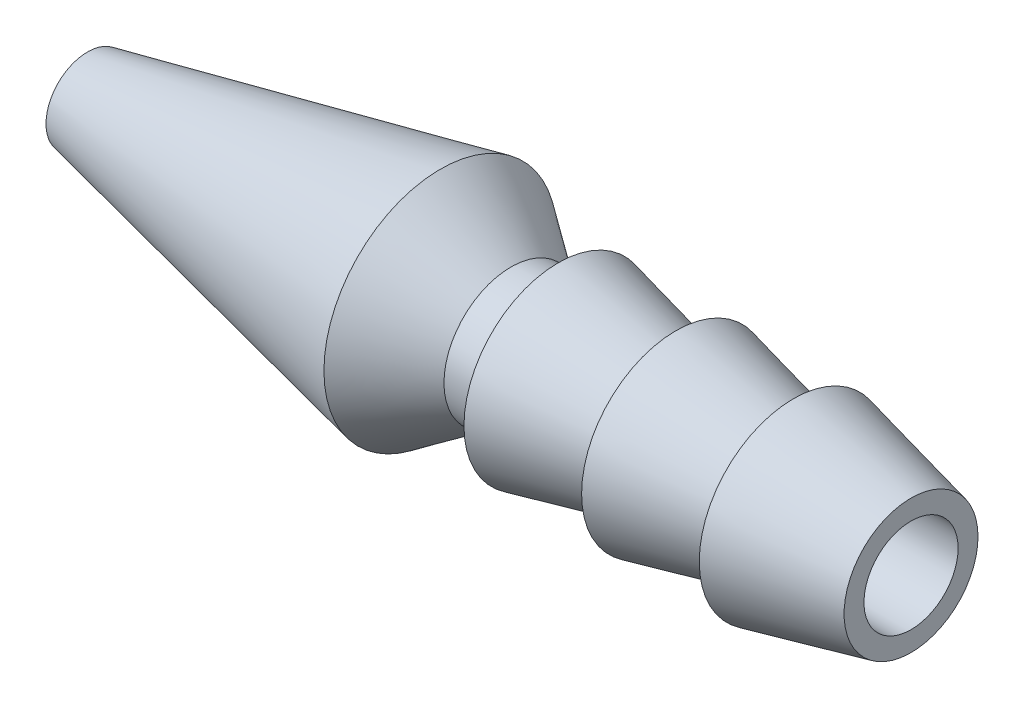
from build123d import *

# Parameters (mm, degrees)
SKETCH1_R           = 4
BOSS_EXTRUDE1_DEPTH = 5
BOSS_EXTRUDE1_TAPER = 13
SKETCH2_R           = 4
BOSS_EXTRUDE2_DEPTH = 5
BOSS_EXTRUDE2_TAPER = 13
SKETCH3_R           = 4
BOSS_EXTRUDE3_DEPTH = 5
BOSS_EXTRUDE3_TAPER = 13
SKETCH4_R           = 2.85
BOSS_EXTRUDE4_DEPTH = 2
SKETCH5_R           = 2.85
BOSS_EXTRUDE5_DEPTH = 3
BOSS_EXTRUDE5_DRAFT = -35
SKETCH6_R           = 4.950622615
BOSS_EXTRUDE6_DEPTH = 15
BOSS_EXTRUDE6_TAPER = 12
SKETCH9_R           = 2
CUT_EXTRUDE1_DEPTH  = 20
SKETCH11_R          = 0.5
CUT_EXTRUDE2_DEPTH  = 15
CUT_EXTRUDE2_DRAFT  = 5.8


with BuildPart() as part:
    # Sketch1 → Boss-Extrude1 (new body)
    with BuildSketch(Plane(origin=(0, 0, 0), x_dir=(0, 0, -1), z_dir=(1, 0, 0))):
        Circle(SKETCH1_R)
    extrude(amount=BOSS_EXTRUDE1_DEPTH, taper=BOSS_EXTRUDE1_TAPER)

    # Sketch2 → Boss-Extrude2 (add)
    with BuildSketch(Plane(origin=(5, 0, 0), x_dir=(0, 0, -1), z_dir=(1, 0, 0))):
        Circle(SKETCH2_R)
    extrude(amount=BOSS_EXTRUDE2_DEPTH, taper=BOSS_EXTRUDE2_TAPER)

    # Sketch3 → Boss-Extrude3 (add)
    with BuildSketch(Plane(origin=(10, 0, 0), x_dir=(0, 0, -1), z_dir=(1, 0, 0))):
        Circle(SKETCH3_R)
    extrude(amount=BOSS_EXTRUDE3_DEPTH, taper=BOSS_EXTRUDE3_TAPER)

    # Sketch4 → Boss-Extrude4 (add)
    with BuildSketch(Plane.ZY):
        Circle(SKETCH4_R)
    extrude(amount=BOSS_EXTRUDE4_DEPTH)


with BuildPart() as boss_extrude5_tool:
    # Sketch5 → Boss-Extrude5 (with draft: the straight prism first)
    with BuildSketch(Plane.ZY.offset(2)):
        Circle(SKETCH5_R)
    extrude(amount=BOSS_EXTRUDE5_DEPTH)
    # Boss-Extrude5: the draft: its side faces are tilted about the plane it starts from
    boss_extrude5_sides = [boss_extrude5_tool.faces().sort_by_distance(p)[0] for p in [
        (-3.5, 0, -2.85),
    ]]
    draft(boss_extrude5_sides, Plane.ZY.offset(2), BOSS_EXTRUDE5_DRAFT)


with BuildPart() as part_1:
    add(part.part)

    # Boss-Extrude5: add boss_extrude5_tool
    add(boss_extrude5_tool.part)

    # Sketch6 → Boss-Extrude6 (add)
    with BuildSketch(Plane.ZY.offset(5)):
        Circle(SKETCH6_R)
    extrude(amount=BOSS_EXTRUDE6_DEPTH, taper=BOSS_EXTRUDE6_TAPER)

    # Sketch9 → Cut-Extrude1 (cut)
    with BuildSketch(Plane(origin=(15, 0, 0), x_dir=(0, 0, -1), z_dir=(1, 0, 0))):
        Circle(SKETCH9_R)
    extrude(amount=-CUT_EXTRUDE1_DEPTH, mode=Mode.SUBTRACT)


with BuildPart() as cut_extrude2_tool:
    # Sketch11 → Cut-Extrude2 (with draft: the straight prism first)
    with BuildSketch(Plane.ZY.offset(20)):
        Circle(SKETCH11_R)
    extrude(amount=-CUT_EXTRUDE2_DEPTH)
    # Cut-Extrude2: the draft: its side faces are tilted about the plane it starts from
    cut_extrude2_sides = [cut_extrude2_tool.faces().sort_by_distance(p)[0] for p in [
        (-12.5, 0, -0.5),
    ]]
    draft(cut_extrude2_sides, Plane.ZY.offset(20), CUT_EXTRUDE2_DRAFT)


with BuildPart() as part_2:
    add(part_1.part)

    # Cut-Extrude2: cut by cut_extrude2_tool
    add(cut_extrude2_tool.part, mode=Mode.SUBTRACT)


solid = part_2.part
